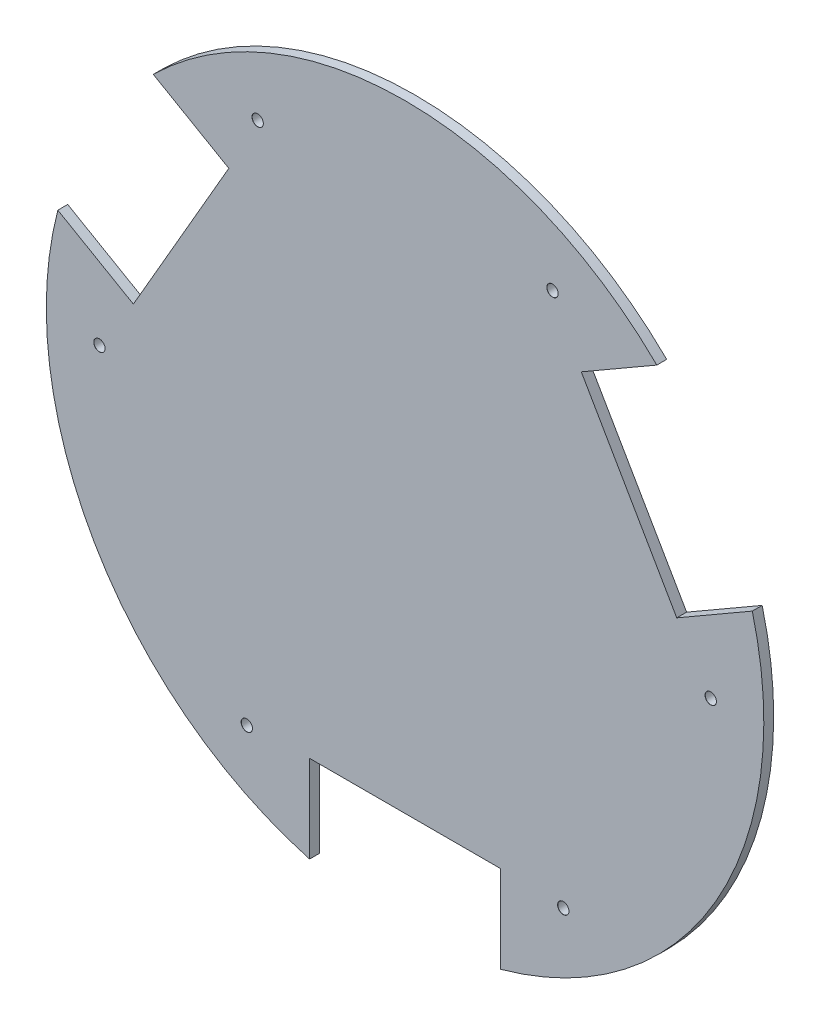
from build123d import *

# Parameters (mm, degrees)
ESQUISSE2_R                  = 109
BOSS_EXTRU_1_DEPTH           = 3
ESQUISSE3_W                  = 58
ESQUISSE3_H                  = 42.41769301
ENL_V_MAT_EXTRU_1_DEPTH      = 3
D_GAGEMENT_M31_D             = 3.4
D_GAGEMENT_M31_CSINK_D       = 3.45
D_GAGEMENT_M31_CSINK_ANGLE   = 90
R_P_TITION_CIRCULAIRE1_COUNT = 3


with BuildPart() as part:
    # Esquisse2 → Boss.-Extru.1 (new body)
    with BuildSketch(Plane.XY):
        Circle(ESQUISSE2_R)
    extrude(amount=BOSS_EXTRU_1_DEPTH)

    # Esquisse3 → Enlèv. mat.-Extru.1 (cut)
    with BuildSketch(Plane.XY.offset(3)):
        with Locations((0, -99.780250798)):
            Rectangle(ESQUISSE3_W, ESQUISSE3_H)
        Polygon((-90.279631846, 85.609285361), (-119.279631846, 35.379811942), (-82.544832128, 14.170965437), (-53.544832128, 64.400438856), align=None)
        Polygon((119.279631846, 35.379811942), (90.279631846, 85.609285361), (53.544832128, 64.400438856), (82.544832128, 14.170965437), align=None)
    extrude(amount=-ENL_V_MAT_EXTRU_1_DEPTH, mode=Mode.SUBTRACT)

    # Dégagement M31 (through all)
    with Locations(Plane.XY.offset(3)):
        with Locations((-48.088245044, -79.426901276), (48.068989794, -79.426901276)):
            d_gagement_m31 = CounterSinkHole(D_GAGEMENT_M31_D / 2, D_GAGEMENT_M31_CSINK_D / 2, counter_sink_angle=D_GAGEMENT_M31_CSINK_ANGLE)

    # Répétition circulaire1: Dégagement M31 ×3 about axis
    r_p_tition_circulaire1_axis = Axis((5.584e-06, 0.046063312, 0), (0, 0, 1))
    for i in range(1, R_P_TITION_CIRCULAIRE1_COUNT):
        add(d_gagement_m31.rotate(r_p_tition_circulaire1_axis, i * 360 / R_P_TITION_CIRCULAIRE1_COUNT), mode=Mode.SUBTRACT)


solid = part.part
